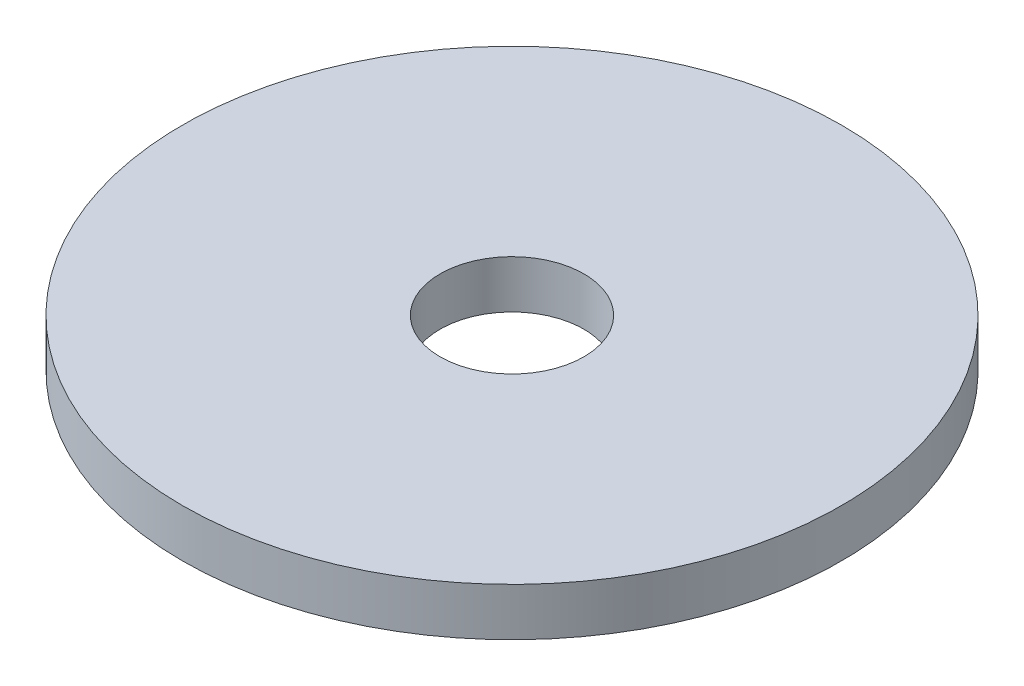
from build123d import *

# Parameters (mm, degrees)
SKETCH1_R           = 27.5
SKETCH1_R_2         = 6
BOSS_EXTRUDE1_DEPTH = 4
CUT_EXTRUDE1_DEPTH  = 40.096035605


with BuildPart() as part:
    # Sketch1 → Boss-Extrude1 (new body)
    with BuildSketch(Plane(origin=(0, 0, 0), x_dir=(1, 0, 0), z_dir=(0, 1, 0))):
        with Locations(Location((0, 0, 0), (0, 0, 270))):
            Circle(SKETCH1_R)
        with Locations(Location((0, 0, 0), (0, 0, 270))):
            Circle(SKETCH1_R_2, mode=Mode.SUBTRACT)
    extrude(amount=BOSS_EXTRUDE1_DEPTH)

    # Sketch2 → Cut-Extrude1 (cut, through all)
    with BuildSketch(Plane.XZ):
        with BuildLine():
            add(Edge.make_bspline(
                [(92.734841855, -25.4730228), (92.965157541, -25.618234301), (93.389383477, -25.990054734), (93.811547169, -26.713779184), (93.985874664, -27.517570704), (93.906861822, -28.332985422), (93.578628842, -29.090729437), (93.030658999, -29.710326898), (92.326361078, -30.126340978), (91.532801279, -30.308187815), (90.707547313, -30.237916672), (90.191822152, -30.016939886), (89.961506467, -29.871728385)],
                knots=[0, 0, 0, 0, 0.000808841, 0.001617682, 0.002426523, 0.003235364, 0.004044205, 0.004853046, 0.005661887, 0.006470728, 0.007279569, 0.00808841, 0.00808841, 0.00808841, 0.00808841], degree=3, weights=[1, 1, 1, 1, 1, 1, 1, 1, 1, 1, 1, 1, 1]))
            add(Edge.make_bspline(
                [(89.961506467, -29.871728385), (89.731190781, -29.726516883), (89.306964845, -29.35469645), (88.884801152, -28.630972), (88.710473657, -27.827180481), (88.789486499, -27.011765762), (89.11771948, -26.254021747), (89.665689323, -25.634424286), (90.369987243, -25.218410206), (91.163547042, -25.036563369), (91.988801009, -25.106834512), (92.504526169, -25.327811298), (92.734841855, -25.4730228)],
                knots=[0, 0, 0, 0, 0.000808841, 0.001617682, 0.002426523, 0.003235364, 0.004044205, 0.004853046, 0.005661887, 0.006470728, 0.007279569, 0.00808841, 0.00808841, 0.00808841, 0.00808841], degree=3, weights=[1, 1, 1, 1, 1, 1, 1, 1, 1, 1, 1, 1, 1]))
        make_face()
        with BuildLine():
            add(Edge.make_bspline(
                [(82.658162865, -45.590441633), (82.888478551, -45.735653135), (83.314756146, -46.109160232), (83.73790355, -46.837695487), (83.910192209, -47.646416028), (83.82682345, -48.462840804), (83.496833783, -49.214225009), (82.957577241, -49.822722069), (82.262350453, -50.239603284), (81.453080963, -50.426703962), (80.631692055, -50.355010666), (80.115143162, -50.13435872), (79.884827477, -49.989147219)],
                knots=[0, 0, 0, 0, 0.000808815, 0.00161763, 0.002426445, 0.00323526, 0.004044074, 0.004852889, 0.005661704, 0.006470519, 0.007279334, 0.008088149, 0.008088149, 0.008088149, 0.008088149], degree=3, weights=[1, 1, 1, 1, 1, 1, 1, 1, 1, 1, 1, 1, 1]))
            add(Edge.make_bspline(
                [(79.884827477, -49.989147219), (79.654511791, -49.843935717), (79.228234196, -49.47042862), (78.805086791, -48.741893365), (78.632798132, -47.933172824), (78.716166891, -47.116748048), (79.046156558, -46.365363843), (79.5854131, -45.756866783), (80.280639889, -45.339985568), (81.089909378, -45.15288489), (81.911298287, -45.224578186), (82.427847179, -45.445230132), (82.658162865, -45.590441633)],
                knots=[0, 0, 0, 0, 0.000808815, 0.00161763, 0.002426445, 0.00323526, 0.004044074, 0.004852889, 0.005661704, 0.006470519, 0.007279334, 0.008088149, 0.008088149, 0.008088149, 0.008088149], degree=3, weights=[1, 1, 1, 1, 1, 1, 1, 1, 1, 1, 1, 1, 1]))
        make_face()
        with BuildLine():
            add(Edge.make_bspline(
                [(92.26868375, -68.774516627), (92.038368064, -68.629305125), (91.614142129, -68.257484692), (91.191978436, -67.533760242), (91.017650941, -66.729968722), (91.096663783, -65.914554004), (91.424896763, -65.156809989), (91.972866607, -64.537212528), (92.677164527, -64.121198448), (93.470724326, -63.939351611), (94.295978292, -64.009622754), (94.811703453, -64.23059954), (95.042019138, -64.375811041)],
                knots=[0, 0, 0, 0, 0.000808841, 0.001617682, 0.002426523, 0.003235364, 0.004044205, 0.004853046, 0.005661887, 0.006470728, 0.007279569, 0.00808841, 0.00808841, 0.00808841, 0.00808841], degree=3, weights=[1, 1, 1, 1, 1, 1, 1, 1, 1, 1, 1, 1, 1]))
            add(Edge.make_bspline(
                [(95.042019138, -64.375811041), (95.272334824, -64.521022543), (95.69656076, -64.892842976), (96.118724453, -65.616567426), (96.293051948, -66.420358946), (96.214039106, -67.235773664), (95.885806125, -67.993517679), (95.337836282, -68.61311514), (94.633538362, -69.02912922), (93.839978563, -69.210976057), (93.014724596, -69.140704914), (92.498999436, -68.919728128), (92.26868375, -68.774516627)],
                knots=[0, 0, 0, 0, 0.000808841, 0.001617682, 0.002426523, 0.003235364, 0.004044205, 0.004853046, 0.005661887, 0.006470728, 0.007279569, 0.00808841, 0.00808841, 0.00808841, 0.00808841], degree=3, weights=[1, 1, 1, 1, 1, 1, 1, 1, 1, 1, 1, 1, 1]))
        make_face()
        with BuildLine():
            add(Edge.make_bspline(
                [(117.502554402, -63.043761616), (117.732870088, -63.188973117), (118.155551976, -63.559250799), (118.579047256, -64.283111079), (118.753409967, -65.088891652), (118.675381512, -65.900858373), (118.345632397, -66.663284708), (117.796956043, -67.282079118), (117.092695063, -67.697612857), (116.299591136, -67.87891276), (115.475057639, -67.808542783), (114.9595347, -67.587678702), (114.729219014, -67.442467201)],
                knots=[0, 0, 0, 0, 0.000808811, 0.001617622, 0.002426434, 0.003235245, 0.004044056, 0.004852867, 0.005661679, 0.00647049, 0.007279301, 0.008088112, 0.008088112, 0.008088112, 0.008088112], degree=3, weights=[1, 1, 1, 1, 1, 1, 1, 1, 1, 1, 1, 1, 1]))
            add(Edge.make_bspline(
                [(114.729219014, -67.442467201), (114.498903328, -67.297255699), (114.07622144, -66.926978017), (113.65272616, -66.203117737), (113.478363448, -65.397337164), (113.556391903, -64.585370443), (113.886141019, -63.822944108), (114.434817373, -63.204149698), (115.139078353, -62.788615959), (115.93218228, -62.607316056), (116.756715777, -62.677686034), (117.272238716, -62.898550114), (117.502554402, -63.043761616)],
                knots=[0, 0, 0, 0, 0.000808811, 0.001617622, 0.002426434, 0.003235245, 0.004044056, 0.004852867, 0.005661679, 0.00647049, 0.007279301, 0.008088112, 0.008088112, 0.008088112, 0.008088112], degree=3, weights=[1, 1, 1, 1, 1, 1, 1, 1, 1, 1, 1, 1, 1]))
        make_face()
        with BuildLine():
            add(Edge.make_bspline(
                [(124.805898004, -47.325048367), (124.575582318, -47.179836866), (124.151356382, -46.808016432), (123.729192689, -46.084291982), (123.554865194, -45.280500463), (123.633878036, -44.465085744), (123.962111017, -43.707341729), (124.51008086, -43.087744269), (125.21437878, -42.671730188), (126.007938579, -42.489883351), (126.833192546, -42.560154494), (127.348917706, -42.781131281), (127.579233392, -42.926342782)],
                knots=[0, 0, 0, 0, 0.000808841, 0.001617682, 0.002426523, 0.003235364, 0.004044205, 0.004853046, 0.005661887, 0.006470728, 0.007279569, 0.00808841, 0.00808841, 0.00808841, 0.00808841], degree=3, weights=[1, 1, 1, 1, 1, 1, 1, 1, 1, 1, 1, 1, 1]))
            add(Edge.make_bspline(
                [(127.579233392, -42.926342782), (127.809549078, -43.071554283), (128.233775014, -43.443374717), (128.655938707, -44.167099167), (128.830266201, -44.970890686), (128.751253359, -45.786305404), (128.423020379, -46.54404942), (127.875050536, -47.16364688), (127.170752616, -47.579660961), (126.377192817, -47.761507798), (125.55193885, -47.691236655), (125.03621369, -47.470259868), (124.805898004, -47.325048367)],
                knots=[0, 0, 0, 0, 0.000808841, 0.001617682, 0.002426523, 0.003235364, 0.004044205, 0.004853046, 0.005661887, 0.006470728, 0.007279569, 0.00808841, 0.00808841, 0.00808841, 0.00808841], degree=3, weights=[1, 1, 1, 1, 1, 1, 1, 1, 1, 1, 1, 1, 1]))
        make_face()
        with BuildLine():
            add(Edge.make_bspline(
                [(112.42204173, -28.539678959), (112.191726044, -28.394467458), (111.767500109, -28.022647024), (111.345336416, -27.298922574), (111.171008921, -26.495131055), (111.250021763, -25.679716336), (111.578254743, -24.921972321), (112.126224587, -24.302374861), (112.830522507, -23.88636078), (113.624082306, -23.704513943), (114.449336272, -23.774785086), (114.965061433, -23.995761873), (115.195377118, -24.140973374)],
                knots=[0, 0, 0, 0, 0.000808841, 0.001617682, 0.002426523, 0.003235364, 0.004044205, 0.004853046, 0.005661887, 0.006470728, 0.007279569, 0.00808841, 0.00808841, 0.00808841, 0.00808841], degree=3, weights=[1, 1, 1, 1, 1, 1, 1, 1, 1, 1, 1, 1, 1]))
            add(Edge.make_bspline(
                [(115.195377118, -24.140973374), (115.425692804, -24.286184875), (115.84991874, -24.658005309), (116.272082433, -25.381729759), (116.446409928, -26.185521278), (116.367397086, -27.000935996), (116.039164105, -27.758680012), (115.491194262, -28.378277472), (114.786896342, -28.794291553), (113.993336543, -28.97613839), (113.168082576, -28.905867247), (112.652357416, -28.68489046), (112.42204173, -28.539678959)],
                knots=[0, 0, 0, 0, 0.000808841, 0.001617682, 0.002426523, 0.003235364, 0.004044205, 0.004853046, 0.005661887, 0.006470728, 0.007279569, 0.00808841, 0.00808841, 0.00808841, 0.00808841], degree=3, weights=[1, 1, 1, 1, 1, 1, 1, 1, 1, 1, 1, 1, 1]))
        make_face()
    extrude(amount=-CUT_EXTRUDE1_DEPTH, mode=Mode.SUBTRACT)


solid = part.part
